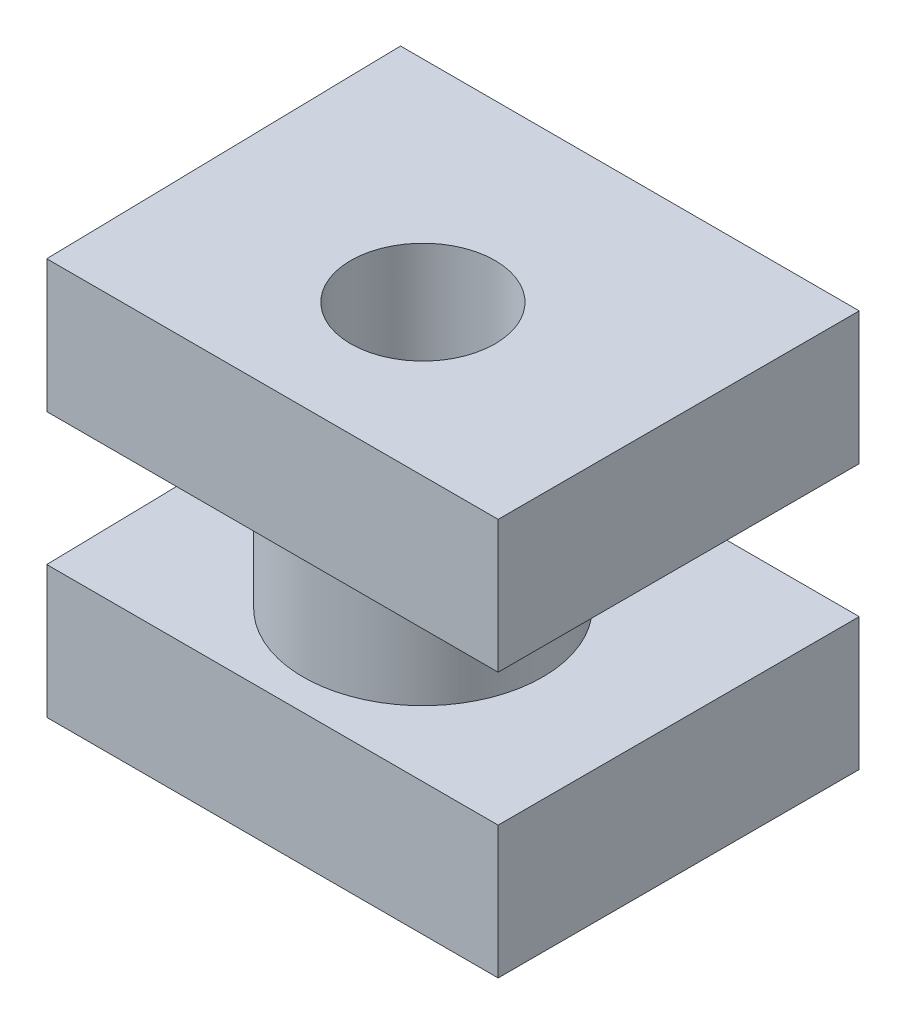
from build123d import *
from build123d.topology import SkipClean

# Parameters (mm, degrees)
SKETCH1_R           = 1.2
BOSS_EXTRUDE1_DEPTH = 2.2
BOSS_EXTRUDE2_START = 2.2
SKETCH2_R           = 1.2
BOSS_EXTRUDE2_DEPTH = 2.2
SKETCH3_R           = 1.2
BOSS_EXTRUDE3_DEPTH = 2.2


with BuildPart() as part:
    # Sketch1 → Boss-Extrude1 (new body)
    with BuildSketch(Plane(origin=(0, 0, 0), x_dir=(1, 0, 0), z_dir=(0, 1, 0))):
        with BuildLine():
            Line((-5.035, 1.393945325), (-5.035, 3.24734466))
            Line((-5.035, 3.24734466), (-2.8, 3.24734466))
            Line((-2.8, 3.24734466), (-2.8, 1.393945325))
            ThreePointArc((-2.8, 1.393945325), (-3.9175, -2.24265534), (-5.035, 1.393945325))
        make_face()
        with Locations(Location((-3.9175, -0.25265534, 0), (0, 0, 270))):
            Circle(SKETCH1_R, mode=Mode.SUBTRACT)
    extrude(amount=BOSS_EXTRUDE1_DEPTH)

    # Sketch2 → Boss-Extrude2 (add)
    with SkipClean():  # the faces are left unmerged after this step: merging them gives an invalid solid
        with BuildSketch(Plane.XZ.offset(BOSS_EXTRUDE2_START)):
            Polygon((-3.9175, -3.24734466), (-0.1675, -3.24734466), (-0.1675, 2.75265534), (-7.6675, 2.75265534), (-7.789861557, -3.24734466), align=None)
            with Locations(Location((-3.9175, 0.25265534, 0), (0, 0, 270))):
                Circle(SKETCH2_R, mode=Mode.SUBTRACT)
        extrude(amount=-BOSS_EXTRUDE2_DEPTH)

    # Sketch3 → Boss-Extrude3 (add)
    with BuildSketch(Plane(origin=(0, 2.2, 0), x_dir=(1, 0, 0), z_dir=(0, 1, 0))):
        Polygon((-7.789861557, 3.24734466), (-5.035, 3.24734466), (-2.8, 3.24734466), (-0.1675, 3.24734466), (-0.1675, -2.75265534), (-7.6675, -2.75265534), align=None)
        with Locations(Location((-3.9175, -0.25265534, 0), (0, 0, 90))):
            Circle(SKETCH3_R, mode=Mode.SUBTRACT)
    extrude(amount=BOSS_EXTRUDE3_DEPTH)


solid = part.part
